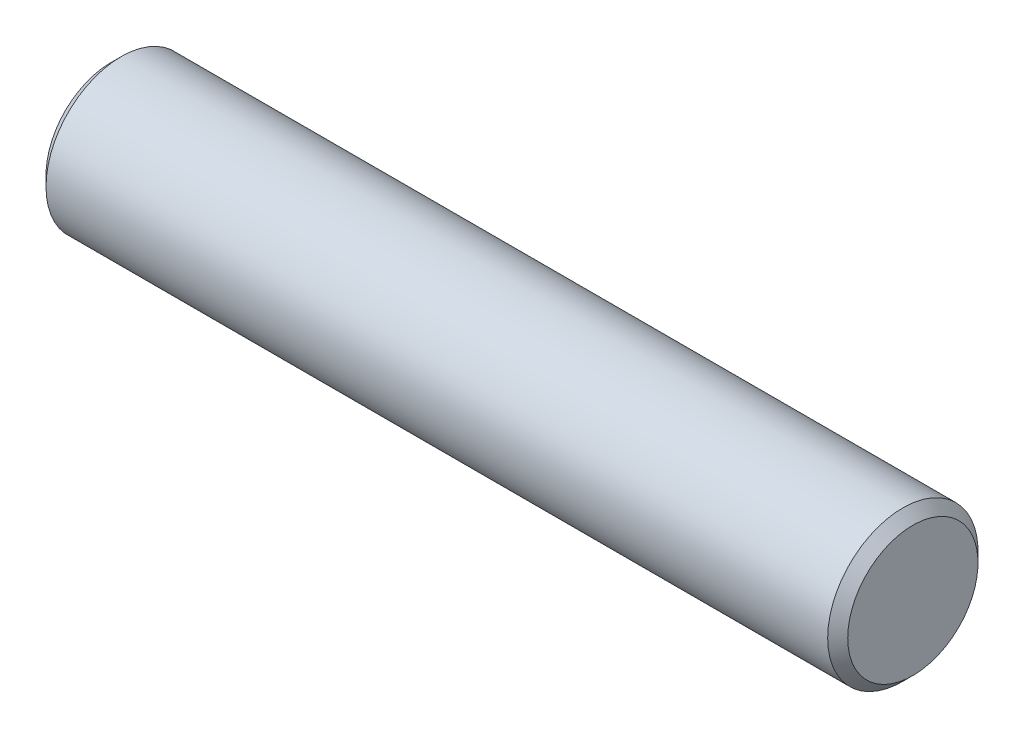
from build123d import *

# Parameters (mm, degrees)
SKETCH_1_W     = 16
SKETCH_1_H     = 1.5
CHAMFER_1_SIZE = 0.2


with BuildPart() as part:
    # 草图1 → 旋转1 (revolve)
    with BuildSketch(Plane.XY, mode=Mode.PRIVATE) as revolve_1_sk:
        with Locations((2.657303371, 0.75)):
            Rectangle(SKETCH_1_W, SKETCH_1_H)
    revolve(revolve_1_sk.sketch.rotate(Axis((-6.320224719, 0, 0), (1, 0, 0)), 90), axis=Axis((-6.320224719, 0, 0), (1, 0, 0)))

    # 倒角1
    chamfer_1_edges = [part.edges().sort_by_distance(p)[0] for p in [
        (10.657303371, 0, -1.5),
        (-5.342696629, 0, -1.5),
    ]]
    chamfer(chamfer_1_edges, length=CHAMFER_1_SIZE)


solid = part.part
